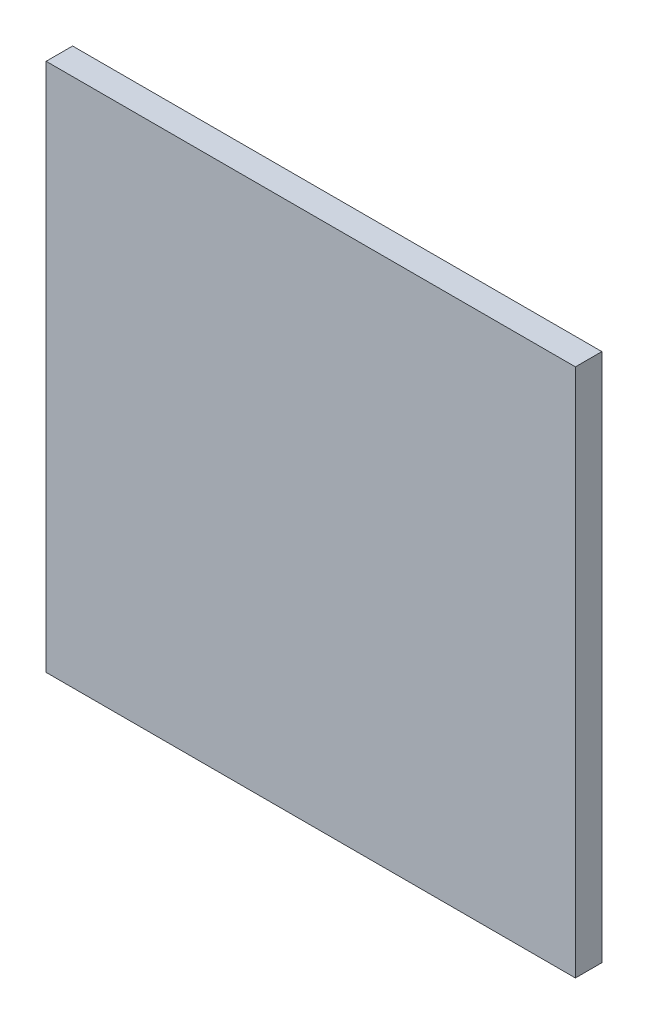
from build123d import *

# Parameters (mm, degrees)
ESBO_O1_W                = 60
ESBO_O1_H                = 60
RESSALTO_EXTRUS_O1_DEPTH = 3


with BuildPart() as part:
    # Esboço1 → Ressalto-extrusão1 (new body)
    with BuildSketch(Plane.XY):
        with Locations((-30, 30)):
            Rectangle(ESBO_O1_W, ESBO_O1_H)
    extrude(amount=RESSALTO_EXTRUS_O1_DEPTH)


solid = part.part
